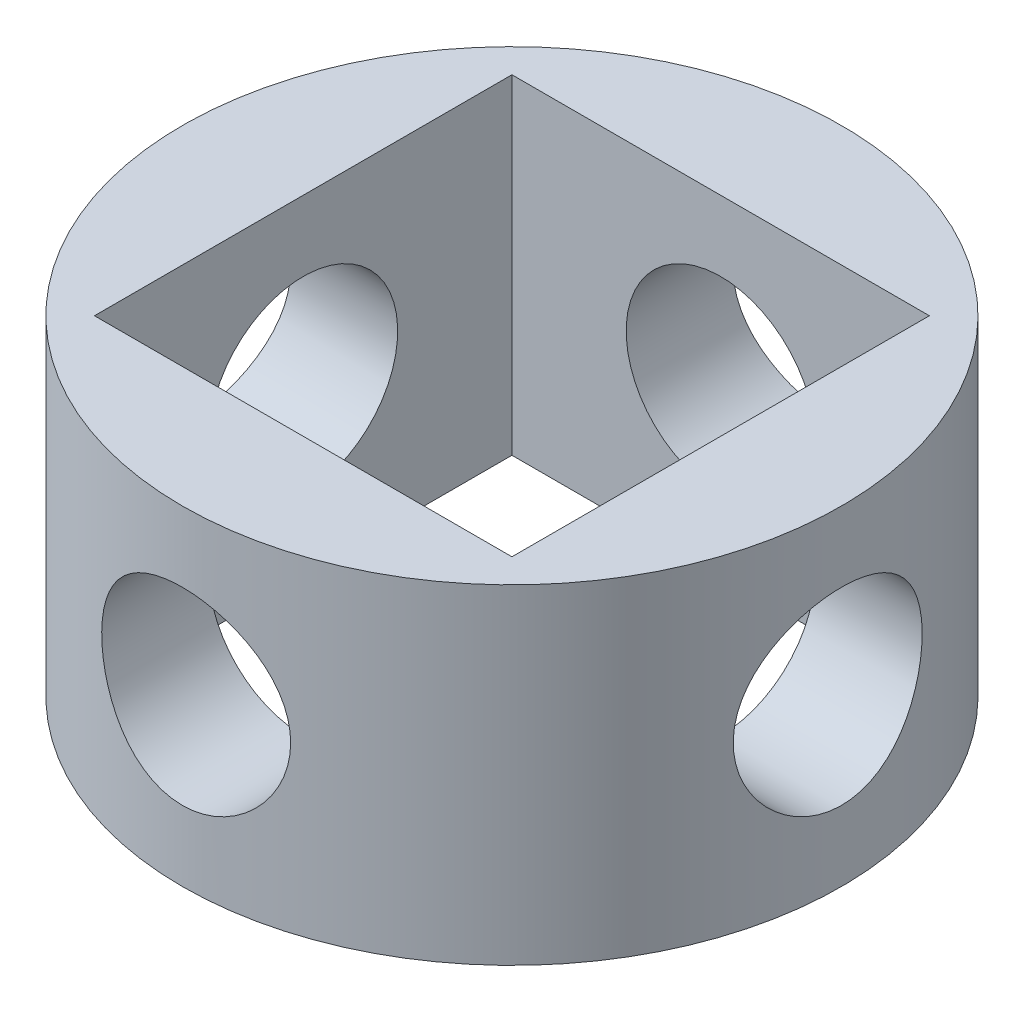
from build123d import *

# Parameters (mm, degrees)
SKETCH1_R               = 150
BOSS_EXTRUDE1_DEPTH     = 150
SKETCH2_W               = 190
SKETCH2_H               = 190
CUT_EXTRUDE1_DEPTH      = 150
CUT_EXTRUDE2_DEPTH      = 260.807621135
CUT_EXTRUDE2_DEPTH_BACK = 260.807621135
SKETCH3_R               = 43
CUT_EXTRUDE3_DEPTH      = 260.807621309
CUT_EXTRUDE3_DEPTH_BACK = 260.807621309
SKETCH4_R               = 43


with BuildPart() as part:
    # Sketch1 → Boss-Extrude1 (new body)
    with BuildSketch(Plane(origin=(0, 0, 0), x_dir=(1, 0, 0), z_dir=(0, 1, 0))):
        with Locations(Location((0, 0, 0), (0, 0, 270))):
            Circle(SKETCH1_R)
    extrude(amount=BOSS_EXTRUDE1_DEPTH)

    # Sketch2 → Cut-Extrude1 (cut)
    with BuildSketch(Plane(origin=(0, 150, 0), x_dir=(1, 0, 0), z_dir=(0, 1, 0))):
        Rectangle(SKETCH2_W, SKETCH2_H)
    extrude(amount=-CUT_EXTRUDE1_DEPTH, mode=Mode.SUBTRACT)

    # Sketch3 → Cut-Extrude2 (cut, two sides: drawn at the far end of the back side and taken through both)
    with BuildSketch(Plane.XY.offset(-CUT_EXTRUDE2_DEPTH_BACK)):
        with Locations((0, 75)):
            Circle(SKETCH3_R)
    extrude(amount=CUT_EXTRUDE2_DEPTH + CUT_EXTRUDE2_DEPTH_BACK, mode=Mode.SUBTRACT)

    # Sketch4 → Cut-Extrude3 (cut, two sides: drawn at the far end of the back side and taken through both)
    with BuildSketch(Plane(origin=(0, 0, 0), x_dir=(0, 0, -1), z_dir=(1, 0, 0)).offset(-CUT_EXTRUDE3_DEPTH_BACK)):
        with Locations((0, 75)):
            Circle(SKETCH4_R)
    extrude(amount=CUT_EXTRUDE3_DEPTH + CUT_EXTRUDE3_DEPTH_BACK, mode=Mode.SUBTRACT)


solid = part.part
